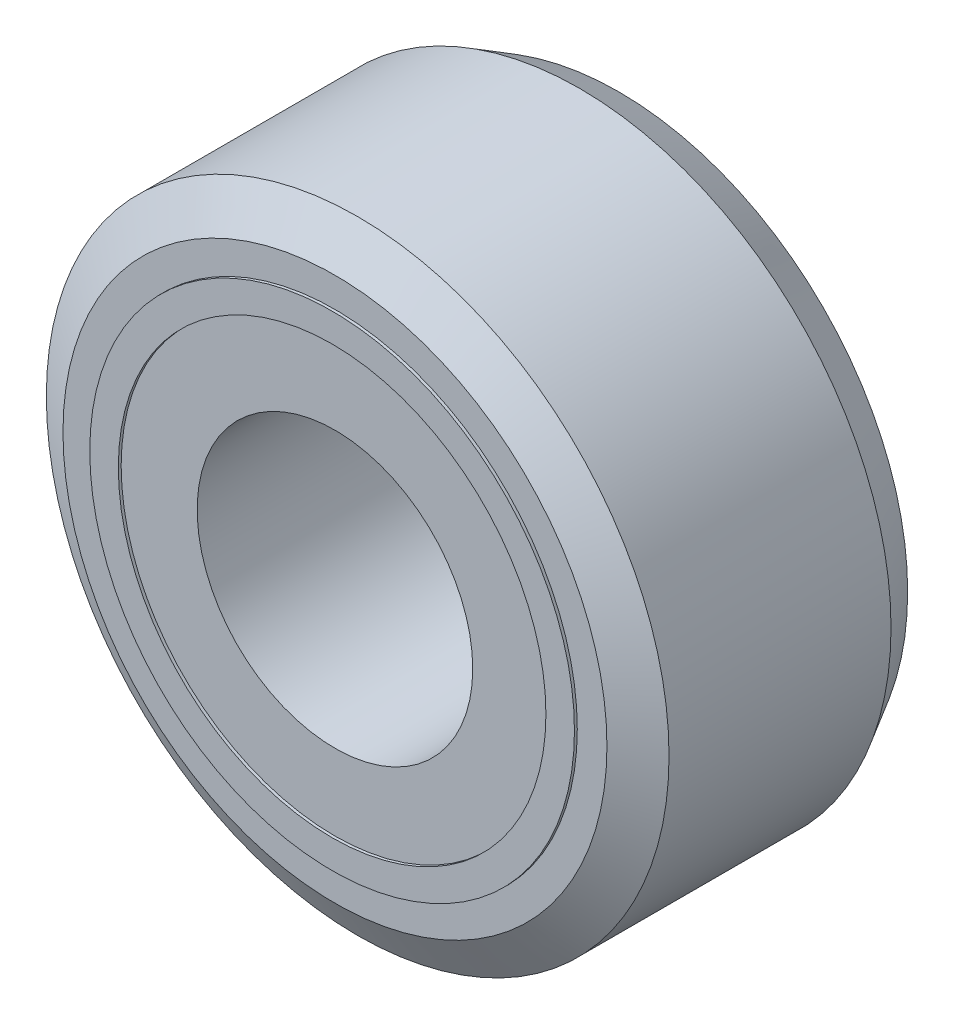
from build123d import *
from OCP.BRepFilletAPI import BRepFilletAPI_MakeChamfer

# Parameters (mm, degrees)
CROQUIS1_R              = 5.48
CROQUIS1_R_2            = 2.425
SALIENTE_EXTRUIR1_DEPTH = 2.5
CHAFL_N1_SIZE           = 0.4
CHAFL_N1_SIZE2          = 0.692820323
CROQUIS2_R              = 4.265221528
CROQUIS2_R_2            = 3.76303741
SALIENTE_EXTRUIR2_DEPTH = 2.55


with BuildPart() as part:
    # Croquis1 → Saliente-Extruir1 (new, symmetric)
    with BuildSketch(Plane.XY):
        Circle(CROQUIS1_R)
        Circle(CROQUIS1_R_2, mode=Mode.SUBTRACT)
    extrude(amount=SALIENTE_EXTRUIR1_DEPTH, both=True)

    # Chaflán1: one chamfer whose edges measure the first distance from different faces: ONE call of the kernel's chamfer builder (chamfer() names one face for all edges)
    chafl_n1_edges_1 = [part.edges().sort_by_distance(p)[0] for p in [
        (-5.48, 0, -2.5),
    ]]
    chafl_n1_side_1 = [part.faces().sort_by_distance(p)[0] for p in [
        (-5.325002194, 0, -2.5),
    ]]
    chafl_n1_edges_2 = [part.edges().sort_by_distance(p)[0] for p in [
        (-5.48, 0, 2.5),
    ]]
    chafl_n1_side_2 = [part.faces().sort_by_distance(p)[0] for p in [
        (-5.48, 0, 0),
    ]]
    chafl_n1 = BRepFilletAPI_MakeChamfer(part.part.solid().wrapped)
    for e in chafl_n1_edges_1:
        chafl_n1.Add(CHAFL_N1_SIZE, CHAFL_N1_SIZE2, e.wrapped, chafl_n1_side_1[0].wrapped)  # the first distance lies on this face
    for e in chafl_n1_edges_2:
        chafl_n1.Add(CHAFL_N1_SIZE, CHAFL_N1_SIZE2, e.wrapped, chafl_n1_side_2[0].wrapped)  # the first distance lies on this face
    add(Compound.cast(chafl_n1.Shape()), mode=Mode.REPLACE)

    # Croquis2 → Saliente-Extruir2 (add, symmetric)
    with BuildSketch(Plane(origin=(0, 0, 0), x_dir=(-1, 0, 0), z_dir=(0, 0, -1))):
        with Locations(Location((0, 0, 0), (0, 0, 180))):
            Circle(CROQUIS2_R)
        with Locations(Location((0, 0, 0), (0, 0, 180))):
            Circle(CROQUIS2_R_2, mode=Mode.SUBTRACT)
    extrude(amount=SALIENTE_EXTRUIR2_DEPTH, both=True)


solid = part.part
